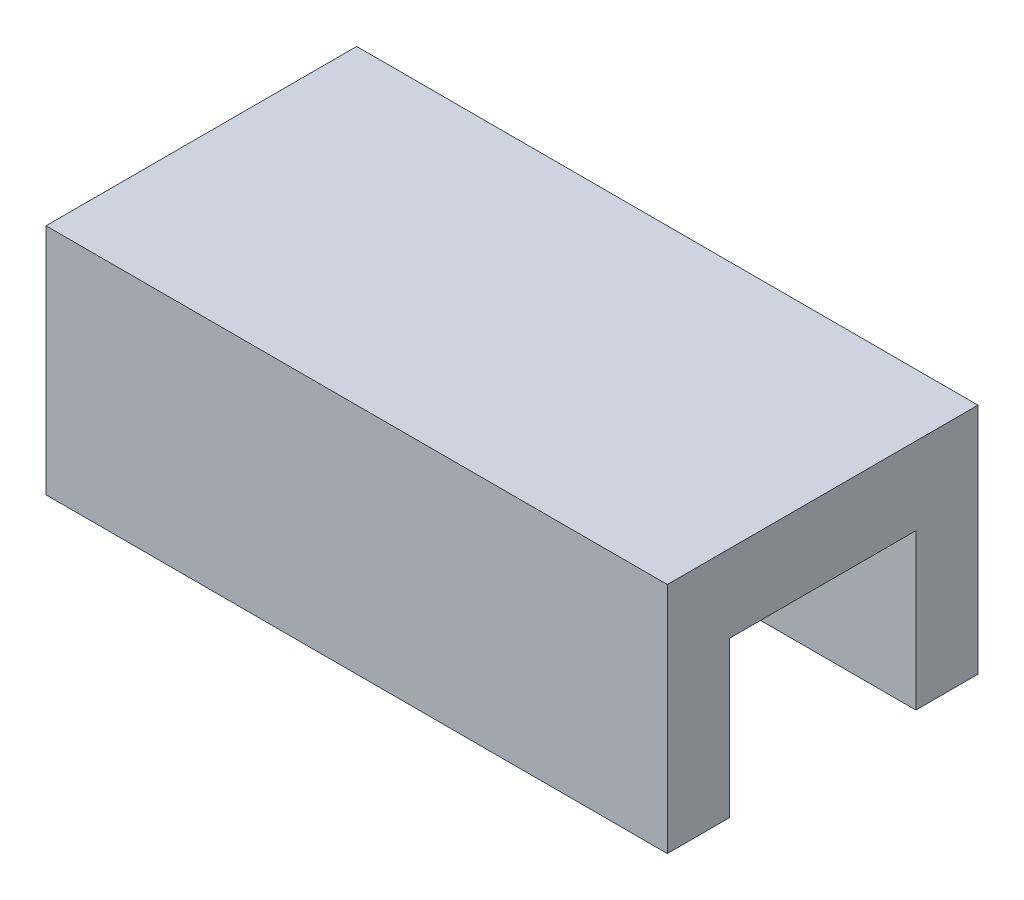
from build123d import *

# Parameters (mm, degrees)
EXTRUDE_1_DEPTH = 40


with BuildPart() as part:
    # 草图1 → 凸台-拉伸1 (new body)
    with BuildSketch(Plane(origin=(0, 0, 0), x_dir=(0, 0, -1), z_dir=(1, 0, 0))):
        Polygon((4, 0), (4, 10), (16, 10), (16, 0), (20, 0), (20, 15), (0, 15), (0, 0), align=None)
    extrude(amount=EXTRUDE_1_DEPTH)


solid = part.part
